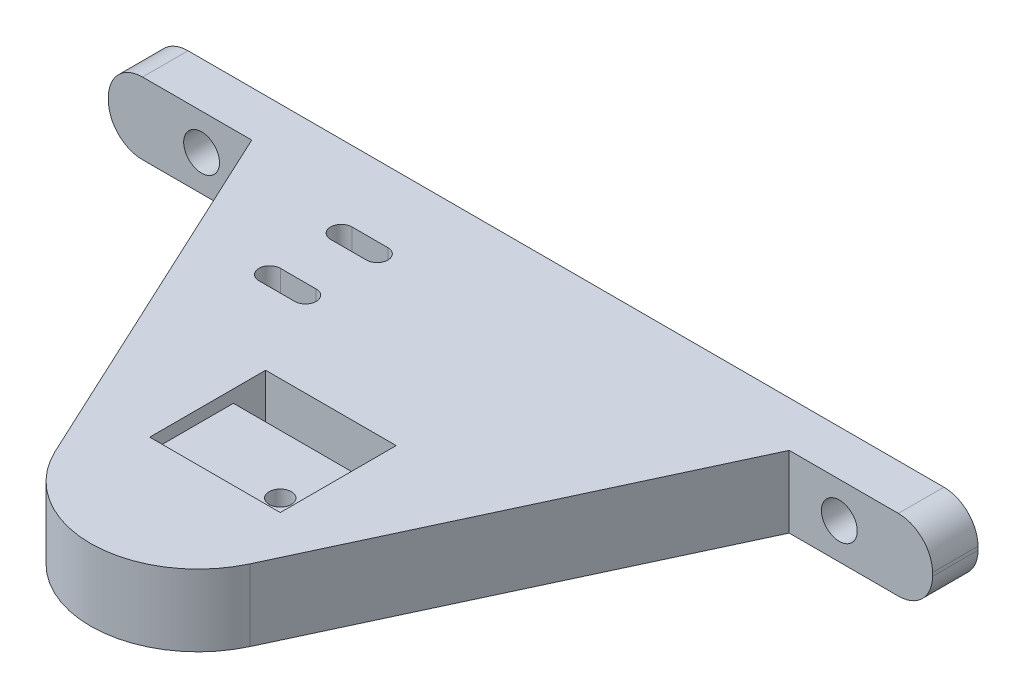
from build123d import *

# Parameters (mm, degrees)
SKETCH1_W              = 115.000000124
SKETCH1_H              = 10
BOSS_EXTRUDE1_DEPTH    = 6.35
BOSS_EXTRUDE3_DEPTH    = 10
M2_5_CLEARANCE_HOLE1_D = 3.1
SKETCH8_W              = 18.22
SKETCH8_H              = 11.68
CUT_EXTRUDE3_DEPTH     = 1.75
SKETCH8_9_W            = 18.22
SKETCH8_9_H            = 4.5
CUT_EXTRUDE4_DEPTH     = 89.366127601
FILLET2_R              = 4.7625
F_5_0MM_DOWEL_HOLE1_D  = 5
CUT_EXTRUDE5_DEPTH     = 89.366127601


with BuildPart() as part:
    # Sketch1 → Boss-Extrude1 (new body)
    with BuildSketch(Plane.XY):
        Rectangle(SKETCH1_W, SKETCH1_H)
    extrude(amount=BOSS_EXTRUDE1_DEPTH)

    # Sketch2 → Boss-Extrude3 (add)
    with BuildSketch(Plane.XZ.offset(5)):
        with BuildLine():
            Line((-37.500000062, 6.35), (37.500000062, 6.35))
            Line((37.500000062, 6.35), (13.598116374, 57.681763663))
            ThreePointArc((13.598116374, 57.681763663), (0, 66.35), (-13.598116374, 57.681763663))
            Line((-13.598116374, 57.681763663), (-37.500000062, 6.35))
        make_face()
    extrude(amount=-BOSS_EXTRUDE3_DEPTH)

    # M2.5 Clearance Hole1 (through all)
    with Locations(Plane(origin=(0, 5, 0), x_dir=(1, 0, 0), z_dir=(0, 1, 0))):
        with Locations((6.005, -45.875)):
            Hole(M2_5_CLEARANCE_HOLE1_D / 2)

    # Sketch8 → Cut-Extrude3 (cut)
    with BuildSketch(Plane(origin=(0, 5, 0), x_dir=(-1, 0, 0), z_dir=(0, 1, 0))):
        with Locations((-0.395, 43.535)):
            Rectangle(SKETCH8_W, SKETCH8_H)
    extrude(amount=-CUT_EXTRUDE3_DEPTH, mode=Mode.SUBTRACT)

    # Sketch8<9> → Cut-Extrude4 (cut, through all)
    with BuildSketch(Plane(origin=(0, 5, 0), x_dir=(-1, 0, 0), z_dir=(0, 1, 0))):
        with Locations((-0.395, 35.445)):
            Rectangle(SKETCH8_9_W, SKETCH8_9_H)
    extrude(amount=-CUT_EXTRUDE4_DEPTH, mode=Mode.SUBTRACT)

    # Fillet2
    fillet2_edges = [part.edges().sort_by_distance(p)[0] for p in [
        (-57.500000062, -5, 3.175),
        (-57.500000062, 5, 3.175),
        (57.500000062, 5, 3.175),
        (57.500000062, -5, 3.175),
    ]]
    fillet(fillet2_edges, radius=FILLET2_R)

    # Ø5.0mm Dowel Hole1 (through all)
    with Locations(Plane.XY.offset(6.35)):
        with Locations((44.5, 0), (-44.5, 0)):
            Hole(F_5_0MM_DOWEL_HOLE1_D / 2)

    # Sketch11 → Cut-Extrude5 (cut, through all)
    with BuildSketch(Plane(origin=(0, 5, 0), x_dir=(1, 0, 0), z_dir=(0, 1, 0))):
        with BuildLine():
            Line((-20.000000062, -9.85), (-15.000000062, -9.85))
            ThreePointArc((-15.000000062, -9.85), (-13.500000062, -11.35), (-15.000000062, -12.85))
            Line((-15.000000062, -12.85), (-20.000000062, -12.85))
            ThreePointArc((-20.000000062, -12.85), (-21.500000062, -11.35), (-20.000000062, -9.85))
        make_face()
        with BuildLine():
            Line((-20.000000062, -19.85), (-15.000000062, -19.85))
            ThreePointArc((-15.000000062, -19.85), (-13.500000062, -21.35), (-15.000000062, -22.85))
            Line((-15.000000062, -22.85), (-20.000000062, -22.85))
            ThreePointArc((-20.000000062, -22.85), (-21.500000062, -21.35), (-20.000000062, -19.85))
        make_face()
    extrude(amount=-CUT_EXTRUDE5_DEPTH, mode=Mode.SUBTRACT)


solid = part.part
